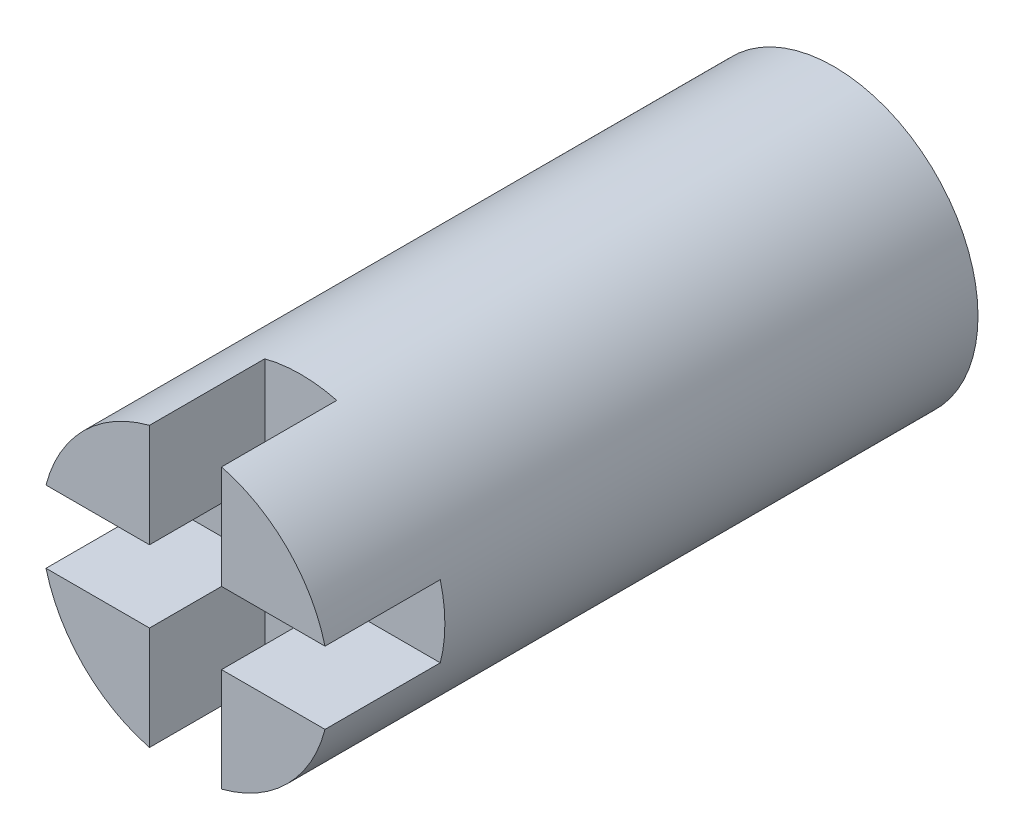
from build123d import *

# Parameters (mm, degrees)
SKETCH1_R           = 6.35
BOSS_EXTRUDE1_DEPTH = 28.575
SKETCH2_R           = 2.9464
CUT_EXTRUDE1_DEPTH  = 12.7
CUT_EXTRUDE2_START  = -5.08
SKETCH4_W           = 3.175
SKETCH4_H           = 3.175
CUT_EXTRUDE2_DEPTH  = 5.08


with BuildPart() as part:
    # Sketch1 → Boss-Extrude1 (new body)
    with BuildSketch(Plane.XY):
        Circle(SKETCH1_R)
    extrude(amount=BOSS_EXTRUDE1_DEPTH)

    # Sketch2 → Cut-Extrude1 (cut)
    with BuildSketch(Plane(origin=(0, 0, 0), x_dir=(-1, 0, 0), z_dir=(0, 0, -1))):
        Circle(SKETCH2_R)
    extrude(amount=-CUT_EXTRUDE1_DEPTH, mode=Mode.SUBTRACT)

    # Sketch4 → Cut-Extrude2 (cut)
    with BuildSketch(Plane.XY.offset(28.575).offset(CUT_EXTRUDE2_START)):
        with BuildLine():
            Line((-1.5875, 6.148361062), (-1.5875, 1.5875))
            Line((-1.5875, 1.5875), (1.5875, 1.5875))
            Line((1.5875, 1.5875), (1.5875, 6.148361062))
            ThreePointArc((1.5875, 6.148361062), (0, 6.35), (-1.5875, 6.148361062))
        make_face()
        Rectangle(SKETCH4_W, SKETCH4_H)
        with BuildLine():
            Line((-6.148361062, -1.5875), (-1.5875, -1.5875))
            Line((-1.5875, -1.5875), (-1.5875, 1.5875))
            Line((-1.5875, 1.5875), (-6.148361062, 1.5875))
            ThreePointArc((-6.148361062, 1.5875), (-6.35, 0), (-6.148361062, -1.5875))
        make_face()
        with BuildLine():
            Line((1.5875, 1.5875), (1.5875, -1.5875))
            Line((1.5875, -1.5875), (6.148361062, -1.5875))
            ThreePointArc((6.148361062, -1.5875), (6.299388571, -0.800127257), (6.35, 0))
            ThreePointArc((6.35, 0), (6.299388571, 0.800127257), (6.148361062, 1.5875))
            Line((6.148361062, 1.5875), (1.5875, 1.5875))
        make_face()
        with BuildLine():
            Line((-1.5875, -1.5875), (-1.5875, -6.148361062))
            ThreePointArc((-1.5875, -6.148361062), (0, -6.35), (1.5875, -6.148361062))
            Line((1.5875, -6.148361062), (1.5875, -1.5875))
            Line((1.5875, -1.5875), (-1.5875, -1.5875))
        make_face()
    extrude(amount=CUT_EXTRUDE2_DEPTH, mode=Mode.SUBTRACT)


solid = part.part
